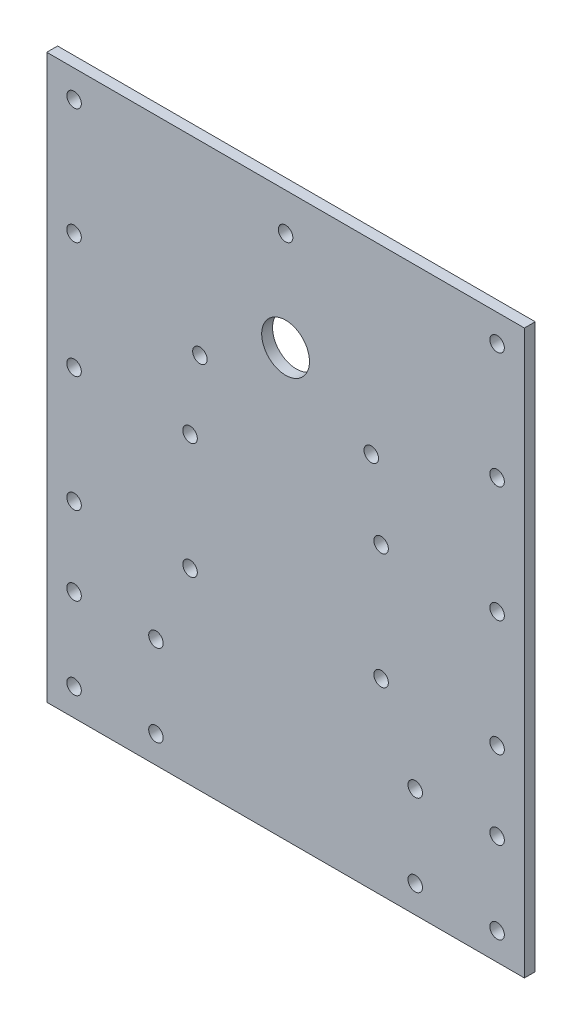
from build123d import *

# Parameters (mm, degrees)
SKETCH1_W           = 140
SKETCH1_H           = 165
SKETCH1_R           = 2.125
SKETCH1_R_2         = 7
BOSS_EXTRUDE1_DEPTH = 3.175
SKETCH2_R           = 2.125
CUT_EXTRUDE1_DEPTH  = 109.242000282


with BuildPart() as part:
    # Sketch1 → Boss-Extrude1 (new body)
    with BuildSketch(Plane.XY):
        Rectangle(SKETCH1_W, SKETCH1_H)
        with Locations((0, 71.5)):
            Circle(SKETCH1_R, mode=Mode.SUBTRACT)
        with Locations((25.11473671, 28)):
            Circle(SKETCH1_R, mode=Mode.SUBTRACT)
        with Locations((-25.11473671, 28)):
            Circle(SKETCH1_R, mode=Mode.SUBTRACT)
        with Locations((0, 42.5)):
            Circle(SKETCH1_R_2, mode=Mode.SUBTRACT)
        with Locations((-62, -74.5)):
            Circle(SKETCH1_R, mode=Mode.SUBTRACT)
        with Locations(Location((-38, -74.5, 0), (0, 0, 180))):
            Circle(SKETCH1_R, mode=Mode.SUBTRACT)
        with Locations((-38, -50.5)):
            Circle(SKETCH1_R, mode=Mode.SUBTRACT)
        with Locations(Location((-62, -50.5, 0), (0, 0, 180))):
            Circle(SKETCH1_R, mode=Mode.SUBTRACT)
        with Locations((38, -74.5)):
            Circle(SKETCH1_R, mode=Mode.SUBTRACT)
        with Locations(Location((62, -74.5, 0), (0, 0, 180))):
            Circle(SKETCH1_R, mode=Mode.SUBTRACT)
        with Locations((62, -50.5)):
            Circle(SKETCH1_R, mode=Mode.SUBTRACT)
        with Locations(Location((38, -50.5, 0), (0, 0, 180))):
            Circle(SKETCH1_R, mode=Mode.SUBTRACT)
    extrude(amount=BOSS_EXTRUDE1_DEPTH)

    # Sketch2 → Cut-Extrude1 (cut, through all)
    with BuildSketch(Plane.XY.offset(3.175)):
        with Locations((-62, 74.5)):
            Circle(SKETCH2_R)
        with Locations((-62, 40.5)):
            Circle(SKETCH2_R)
        with Locations((-62, 6.5)):
            Circle(SKETCH2_R)
        with Locations((-62, -27.5)):
            Circle(SKETCH2_R)
        with Locations((-28, 6.5)):
            Circle(SKETCH2_R)
        with Locations((-28, -27.5)):
            Circle(SKETCH2_R)
        with Locations(Location((28, -27.5, 0), (0, 0, 180))):
            Circle(SKETCH2_R)
        with Locations(Location((28, 6.5, 0), (0, 0, 180))):
            Circle(SKETCH2_R)
        with Locations(Location((62, -27.5, 0), (0, 0, 180))):
            Circle(SKETCH2_R)
        with Locations(Location((62, 6.5, 0), (0, 0, 180))):
            Circle(SKETCH2_R)
        with Locations(Location((62, 40.5, 0), (0, 0, 180))):
            Circle(SKETCH2_R)
        with Locations(Location((62, 74.5, 0), (0, 0, 180))):
            Circle(SKETCH2_R)
    extrude(amount=-CUT_EXTRUDE1_DEPTH, mode=Mode.SUBTRACT)


solid = part.part
